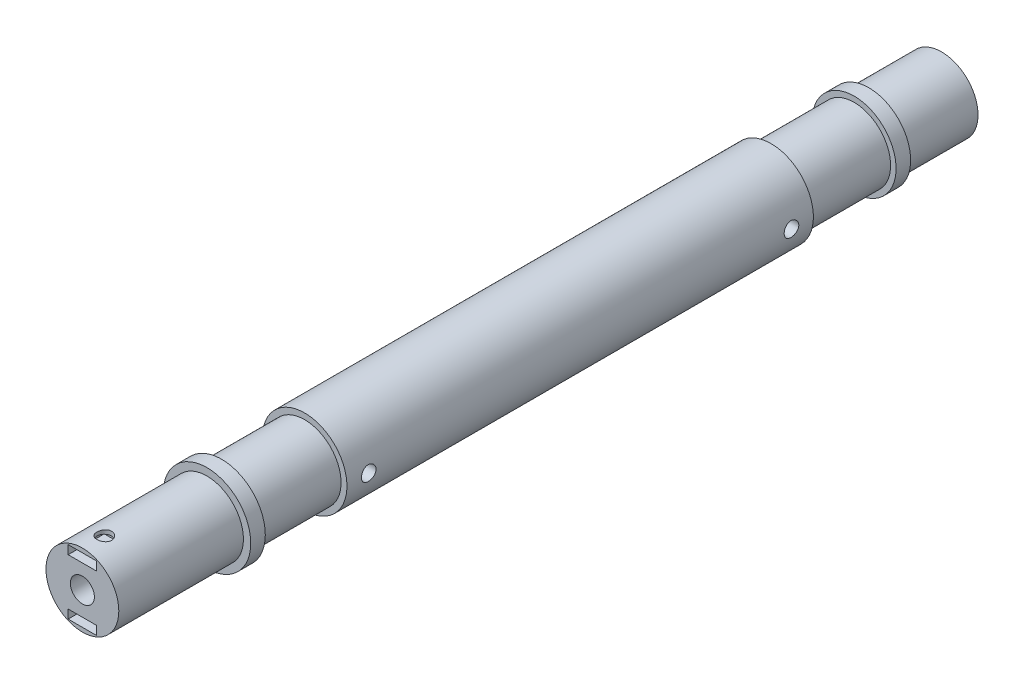
from build123d import *

# Parameters (mm, degrees)
SKETCH1_R           = 6
BOSS_EXTRUDE1_DEPTH = 30.5
SKETCH2_R           = 1.65
CUT_EXTRUDE1_DEPTH  = 14
SKETCH13_W          = 3.9
SKETCH13_H          = 1.2
CUT_EXTRUDE6_DEPTH  = 4.95
SKETCH4_R           = 1
CUT_EXTRUDE7_DEPTH  = 7.5
SKETCH19_R          = 6
SKETCH19_R_2        = 5
CUT_EXTRUDE8_DEPTH  = 45
SKETCH21_R          = 5.8
BOSS_EXTRUDE2_DEPTH = 64
BOSS_EXTRUDE3_START = 13.4
SKETCH22_R          = 5
BOSS_EXTRUDE3_DEPTH = 13.4
BOSS_EXTRUDE5_START = 10
SKETCH24_R          = 5
BOSS_EXTRUDE5_DEPTH = 10
BOSS_EXTRUDE6_START = -19.1
SKETCH25_R          = 6
SKETCH25_R_2        = 5
BOSS_EXTRUDE6_DEPTH = 19.1
CUT_EXTRUDE9_START  = -17.1
SKETCH26_R          = 6
SKETCH26_R_2        = 5
CUT_EXTRUDE9_DEPTH  = 17.1
SKETCH28_R          = 1
CUT_EXTRUDE11_DEPTH = 17
SKETCH23_R          = 5.75
BOSS_EXTRUDE7_DEPTH = 2


with BuildPart() as part:
    # Sketch1 → Boss-Extrude1 (new body)
    with BuildSketch(Plane.XY):
        with Locations(Location((0, 0, 0), (0, 0, 180))):
            Circle(SKETCH1_R)
    extrude(amount=BOSS_EXTRUDE1_DEPTH)

    # Sketch2 → Cut-Extrude1 (cut)
    with BuildSketch(Plane.XY.offset(30.5)):
        Circle(SKETCH2_R)
    extrude(amount=-CUT_EXTRUDE1_DEPTH, mode=Mode.SUBTRACT)

    # Sketch13 → Cut-Extrude6 (cut)
    with BuildSketch(Plane.XY.offset(30.5)):
        with Locations((0, 3.825)):
            Rectangle(SKETCH13_W, SKETCH13_H)
    cut_extrude6 = extrude(amount=-CUT_EXTRUDE6_DEPTH, mode=Mode.SUBTRACT)

    # Sketch4 → Cut-Extrude7 (cut, symmetric)
    with BuildSketch(Plane(origin=(0, 0, 0), x_dir=(1, 0, 0), z_dir=(0, 1, 0))):
        with Locations(Location((0, -27.5, 0), (0, 0, 270))):
            Circle(SKETCH4_R)
    extrude(amount=CUT_EXTRUDE7_DEPTH, both=True, mode=Mode.SUBTRACT)

    # Mirror1: Cut-Extrude6 across plane
    add(cut_extrude6.mirror(Plane.ZX), mode=Mode.SUBTRACT)

    # Sketch19 → Cut-Extrude8 (cut)
    with BuildSketch(Plane(origin=(0, 0, 0), x_dir=(-1, 0, 0), z_dir=(0, 0, -1))):
        Circle(SKETCH19_R)
        Circle(SKETCH19_R_2, mode=Mode.SUBTRACT)
    extrude(amount=-CUT_EXTRUDE8_DEPTH, mode=Mode.SUBTRACT)

    # Sketch21 → Boss-Extrude2 (add)
    with BuildSketch(Plane(origin=(0, 0, 0), x_dir=(-1, 0, 0), z_dir=(0, 0, -1))):
        Circle(SKETCH21_R)
    extrude(amount=BOSS_EXTRUDE2_DEPTH)

    # Sketch22 → Boss-Extrude3 (add)
    with BuildSketch(Plane(origin=(0, 0, -64), x_dir=(-1, 0, 0), z_dir=(0, 0, -1)).offset(BOSS_EXTRUDE3_START)):
        Circle(SKETCH22_R)
    extrude(amount=-BOSS_EXTRUDE3_DEPTH)

    # Sketch24 → Boss-Extrude5 (add)
    with BuildSketch(Plane(origin=(0, 0, -77.4), x_dir=(-1, 0, 0), z_dir=(0, 0, -1)).offset(BOSS_EXTRUDE5_START)):
        Circle(SKETCH24_R)
    extrude(amount=-BOSS_EXTRUDE5_DEPTH)

    # Sketch25 → Boss-Extrude6 (add)
    with BuildSketch(Plane.XY.offset(30.5).offset(BOSS_EXTRUDE6_START)):
        Circle(SKETCH25_R)
        with Locations(Location((0, 0, 0), (0, 0, 180))):
            Circle(SKETCH25_R_2, mode=Mode.SUBTRACT)
    extrude(amount=BOSS_EXTRUDE6_DEPTH)

    # Sketch26 → Cut-Extrude9 (cut)
    with BuildSketch(Plane.XY.offset(30.5).offset(CUT_EXTRUDE9_START)):
        Circle(SKETCH26_R)
        with Locations(Location((0, 0, 0), (0, 0, 180))):
            Circle(SKETCH26_R_2, mode=Mode.SUBTRACT)
    extrude(amount=CUT_EXTRUDE9_DEPTH, mode=Mode.SUBTRACT)

    # Sketch28 → Cut-Extrude11 (cut)
    with BuildSketch(Plane.ZY.offset(5.8)):
        with Locations(Location((-61, 0, 0), (0, 0, 180))):
            Circle(SKETCH28_R)
        with Locations(Location((-3, 0, 0), (0, 0, 180))):
            Circle(SKETCH28_R)
    extrude(amount=-CUT_EXTRUDE11_DEPTH, mode=Mode.SUBTRACT)

    # Sketch23 → Boss-Extrude7 (add)
    with BuildSketch(Plane(origin=(0, 0, -77.4), x_dir=(-1, 0, 0), z_dir=(0, 0, -1))):
        Circle(SKETCH23_R)
    extrude(amount=-BOSS_EXTRUDE7_DEPTH)


solid = part.part
